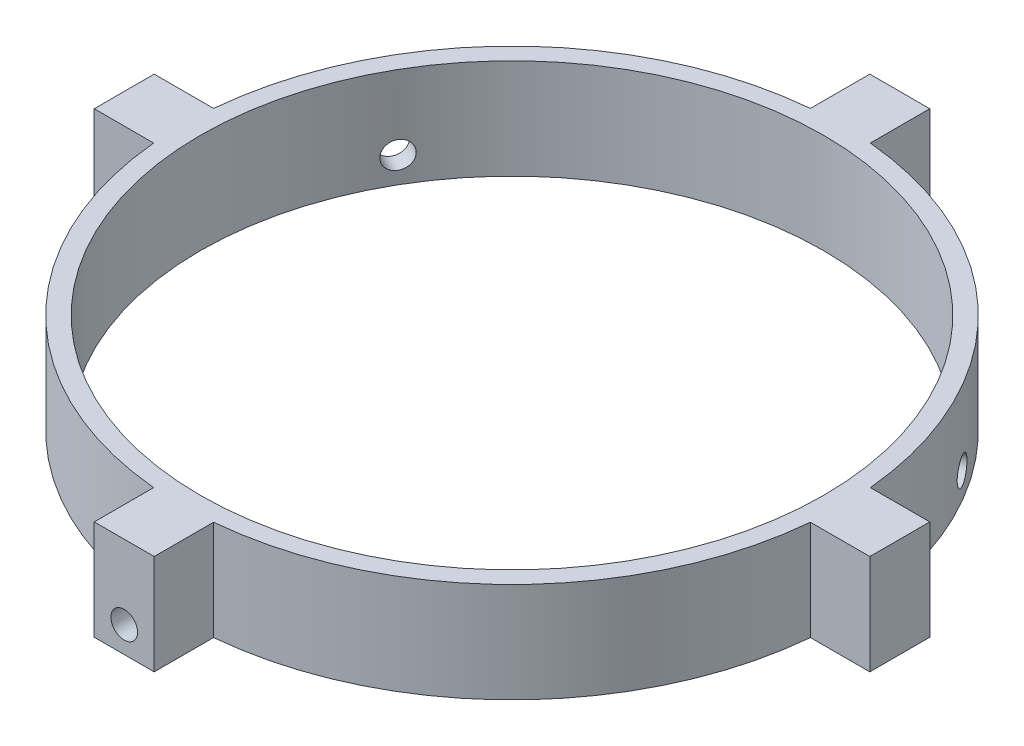
from build123d import *

# Parameters (mm, degrees)
SKETCH1_R           = 42.9384162
SKETCH1_R_2         = 39.624
BOSS_EXTRUDE1_DEPTH = 12.7
SKETCH4_R           = 1.692869147
CUT_EXTRUDE1_DEPTH  = 72.35
CIRPATTERN7_COUNT   = 3
SKETCH6_W           = 6.747965948
SKETCH6_H           = 12.700002404
BOSS_EXTRUDE2_DEPTH = 3.81
CIRPATTERN8_COUNT   = 4
CUT_EXTRUDE2_START  = -8.81
SKETCH7_R           = 1.692869147
CUT_EXTRUDE2_DEPTH  = 8.81
CUT_EXTRUDE3_START  = -24
CUT_EXTRUDE3_DEPTH  = 24


with BuildPart() as part:
    # Sketch1 → Boss-Extrude1 (new body)
    with BuildSketch(Plane(origin=(0, 0, 0), x_dir=(1, 0, 0), z_dir=(0, 1, 0))):
        with Locations(Location((0, 0, 0), (0, 0, 270))):
            Circle(SKETCH1_R)
        with Locations(Location((0, 0, 0), (0, 0, 270))):
            Circle(SKETCH1_R_2, mode=Mode.SUBTRACT)
    extrude(amount=BOSS_EXTRUDE1_DEPTH)

    # Sketch4 → Cut-Extrude1 (cut)
    with BuildSketch(Plane.XY):
        with Locations(Location((0, 3.287142885, 0), (0, 0, 180))):
            Circle(SKETCH4_R)
    cut_extrude1 = extrude(amount=CUT_EXTRUDE1_DEPTH, mode=Mode.SUBTRACT)

    # CirPattern7: Cut-Extrude1 ×3 about axis
    cirpattern7_axis = Axis((0, 0, 0), (0, -1, 0))
    for i in range(1, CIRPATTERN7_COUNT):
        add(cut_extrude1.rotate(cirpattern7_axis, i * 360 / CIRPATTERN7_COUNT), mode=Mode.SUBTRACT)

    # Sketch6 → Boss-Extrude2 (add, symmetric)
    with BuildSketch(Plane.XY):
        with Locations((45.914433226, 6.349998798)):
            Rectangle(SKETCH6_W, SKETCH6_H)
    boss_extrude2 = extrude(amount=BOSS_EXTRUDE2_DEPTH, both=True)

    # CirPattern8: Boss-Extrude2 ×4 about axis
    cirpattern8_axis = Axis((0, 0, 0), (0, 1, 0))
    for i in range(1, CIRPATTERN8_COUNT):
        add(boss_extrude2.rotate(cirpattern8_axis, i * 360 / CIRPATTERN8_COUNT))

    # Sketch7 → Cut-Extrude2 (cut)
    with BuildSketch(Plane.XY.offset(49.2884162).offset(CUT_EXTRUDE2_START)):
        with Locations(Location((0, 3.287142885, 0), (0, 0, 180))):
            Circle(SKETCH7_R)
    extrude(amount=CUT_EXTRUDE2_DEPTH, mode=Mode.SUBTRACT)

    # Sketch8 → Cut-Extrude3 (cut)
    with BuildSketch(Plane(origin=(0, 12.7, 0), x_dir=(1, 0, 0), z_dir=(0, 1, 0)).offset(CUT_EXTRUDE3_START)):
        with BuildLine():
            Line((-41.736458882, -3.81), (-42.769048222, -3.81))
            ThreePointArc((-42.769048222, -3.81), (-30.362045269, -30.362045269), (-3.81, -42.769048222))
            Line((-3.81, -42.769048222), (-3.81, -41.736458882))
            ThreePointArc((-3.81, -41.736458882), (-29.6348452, -29.6348452), (-41.736458882, -3.81))
        make_face()
        with BuildLine():
            Line((3.81, -41.736458882), (3.81, -42.769048222))
            ThreePointArc((3.81, -42.769048222), (30.362045269, -30.362045269), (42.769048222, -3.81))
            Line((42.769048222, -3.81), (41.736458882, -3.81))
            ThreePointArc((41.736458882, -3.81), (29.6348452, -29.6348452), (3.81, -41.736458882))
        make_face()
        with BuildLine():
            ThreePointArc((42.769048222, 3.81), (30.362045269, 30.362045269), (3.81, 42.769048222))
            Line((3.81, 42.769048222), (3.81, 41.736458882))
            ThreePointArc((3.81, 41.736458882), (29.6348452, 29.6348452), (41.736458882, 3.81))
            Line((41.736458882, 3.81), (42.769048222, 3.81))
        make_face()
        with BuildLine():
            ThreePointArc((-3.81, 42.769048222), (-30.362045269, 30.362045269), (-42.769048222, 3.81))
            Line((-42.769048222, 3.81), (-41.736458882, 3.81))
            ThreePointArc((-41.736458882, 3.81), (-29.6348452, 29.6348452), (-3.81, 41.736458882))
            Line((-3.81, 41.736458882), (-3.81, 42.769048222))
        make_face()
    extrude(amount=CUT_EXTRUDE3_DEPTH, mode=Mode.SUBTRACT)


solid = part.part
